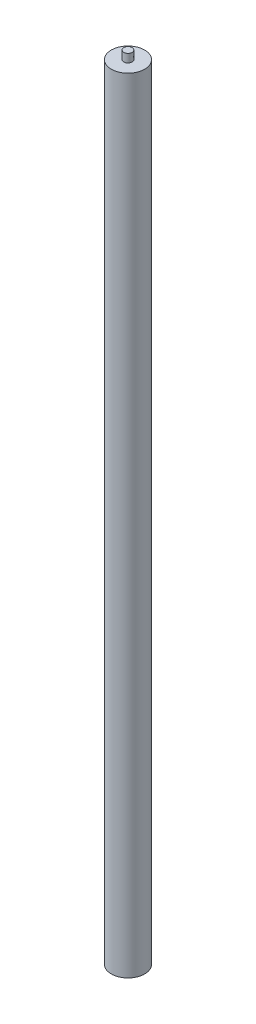
from build123d import *

# Parameters (mm, degrees)
SKETCH1_R                = 12.7
BOSS_EXTRUDE1_DEPTH      = 596.9
BOSS_EXTRUDE2_DEPTH      = 6.35
BOSS_EXTRUDE2_DEPTH_BACK = 603.25
SKETCH2_R                = 3.175


with BuildPart() as part:
    # Sketch1 → Boss-Extrude1 (new body)
    with BuildSketch(Plane(origin=(0, 0, 0), x_dir=(1, 0, 0), z_dir=(0, 1, 0))):
        with Locations(Location((0, 0, 0), (0, 0, 270))):
            Circle(SKETCH1_R)
    extrude(amount=BOSS_EXTRUDE1_DEPTH)

    # Sketch2 → Boss-Extrude2 (add, two sides: drawn at the far end of the back side and taken through both)
    with BuildSketch(Plane(origin=(0, 596.9, 0), x_dir=(-1, 0, 0), z_dir=(0, 1, 0)).offset(-BOSS_EXTRUDE2_DEPTH_BACK)):
        with Locations(Location((0, 0, 0), (0, 0, 90))):
            Circle(SKETCH2_R)
    extrude(amount=BOSS_EXTRUDE2_DEPTH + BOSS_EXTRUDE2_DEPTH_BACK)


solid = part.part
